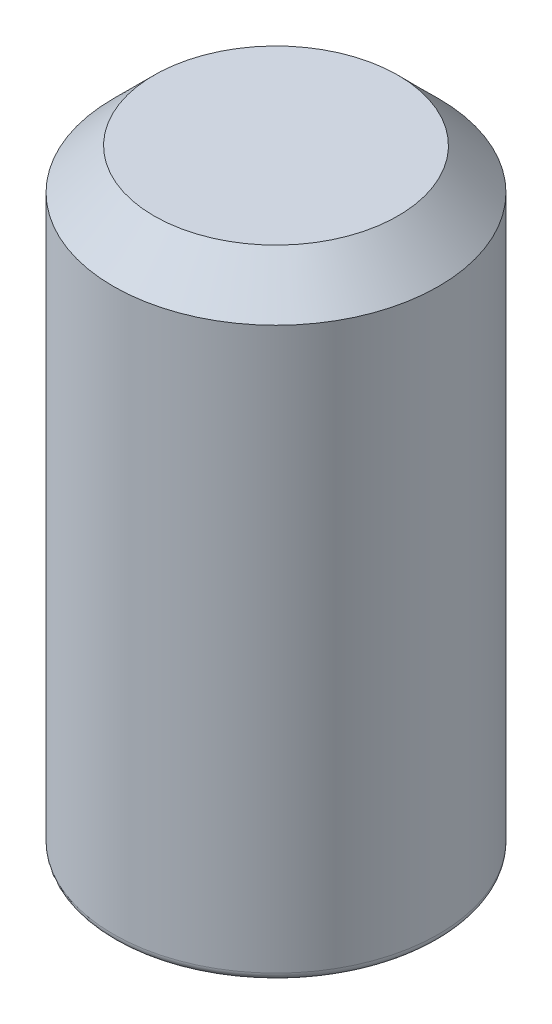
from build123d import *

# Parameters (mm, degrees)
SKETCH_1_R      = 4
EXTRUDE_1_DEPTH = 15
CHAMFER_1_SIZE  = 1
FILLET_1_R      = 0.2


with BuildPart() as part:
    # 草图1 → 凸台-拉伸1 (new body)
    with BuildSketch(Plane(origin=(0, 0, 0), x_dir=(1, 0, 0), z_dir=(0, 1, 0))):
        with Locations(Location((0, 0, 0), (0, 0, 270))):
            Circle(SKETCH_1_R)
    extrude(amount=EXTRUDE_1_DEPTH)

    # 倒角1
    chamfer_1_edges = [part.edges().sort_by_distance(p)[0] for p in [
        (0, 15, -4),
    ]]
    chamfer(chamfer_1_edges, length=CHAMFER_1_SIZE)

    # 圆角1
    fillet_1_edges = [part.edges().sort_by_distance(p)[0] for p in [
        (0, 0, -4),
    ]]
    fillet(fillet_1_edges, radius=FILLET_1_R)


solid = part.part
